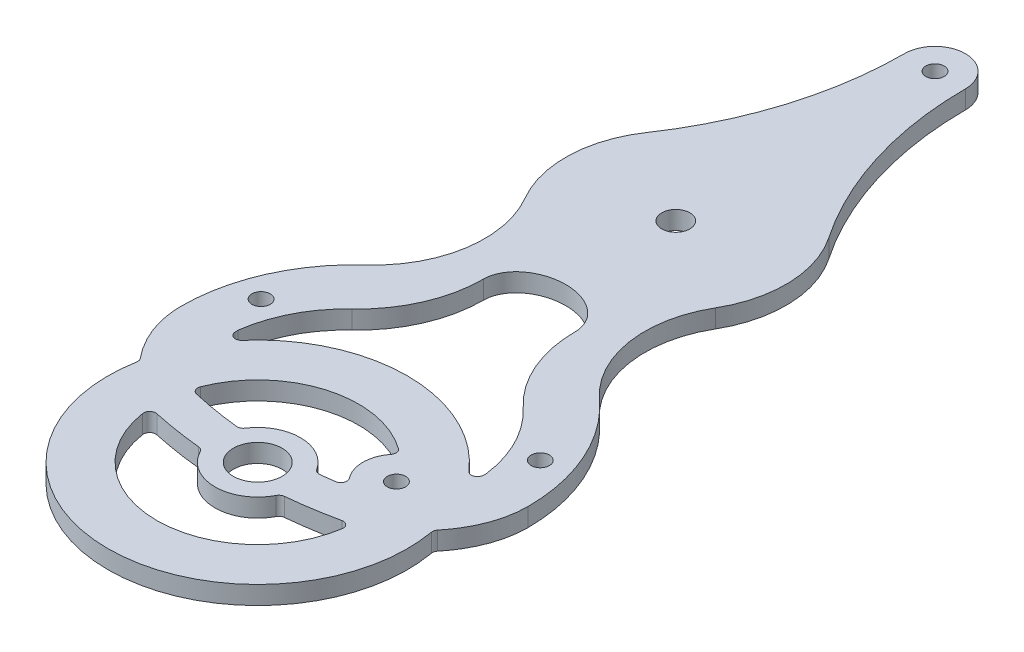
from build123d import *

# Parameters (mm, degrees)
SKETCH1_R           = 24.548545276
SKETCH1_R_2         = 16.548545276
BOSS_EXTRUDE1_DEPTH = 3
BOSS_EXTRUDE2_DEPTH = 3
SKETCH4_R           = 7
BOSS_EXTRUDE3_DEPTH = 3
FILLET1_R           = 1
SKETCH5_R           = 4
SKETCH5_R_2         = 1.5
CUT_EXTRUDE1_DEPTH  = 97.3335884
SKETCH6_R           = 1.5
SKETCH6_R_2         = 2.3
BOSS_EXTRUDE4_DEPTH = 3
FILLET2_R           = 1


with BuildPart() as part:
    # Sketch1 → Boss-Extrude1 (new body)
    with BuildSketch(Plane(origin=(0, 0, 0), x_dir=(1, 0, 0), z_dir=(0, 1, 0))):
        with Locations(Location((0, -68.556390977, 0), (0, 0, 270))):
            Circle(SKETCH1_R)
        with Locations(Location((0, -68.556390977, 0), (0, 0, 270))):
            Circle(SKETCH1_R_2, mode=Mode.SUBTRACT)
    extrude(amount=BOSS_EXTRUDE1_DEPTH)

    # Sketch2 → Boss-Extrude2 (add)
    with BuildSketch(Plane.XZ):
        with BuildLine():
            Line((-24.512516803, 67.2268816), (-23.428814897, 61.2268816))
            ThreePointArc((-23.428814897, 61.2268816), (0, 65.556390977), (23.428814897, 61.2268816))
            Line((23.428814897, 61.2268816), (24.512516803, 67.2268816))
            ThreePointArc((24.512516803, 67.2268816), (0, 71.556390977), (-24.512516803, 67.2268816))
        make_face()
    extrude(amount=-BOSS_EXTRUDE2_DEPTH)

    # Sketch4 → Boss-Extrude3 (add)
    with BuildSketch(Plane.XZ):
        with Locations((0, 68.556390977)):
            Circle(SKETCH4_R)
        with BuildLine():
            ThreePointArc((11.20668667, 64.591412524), (8.63715313, 60.358536924), (10.51197626, 55.775440079))
            ThreePointArc((10.51197626, 55.775440079), (13.727286847, 59.31431618), (15.796618214, 63.624737728))
            ThreePointArc((15.796618214, 63.624737728), (13.510301022, 64.149140012), (11.20668667, 64.591412524))
        make_face()
    extrude(amount=-BOSS_EXTRUDE3_DEPTH)

    # Fillet1
    fillet1_edges = [part.edges().sort_by_distance(p)[0] for p in [
        (-16.514023918, 1.5, 69.624737728),
        (16.514023918, 1.5, 69.624737728),
        (-15.796618214, 1.5, 63.624737728),
        (10.51197626, 1.5, 55.775440079),
        (11.20668667, 1.5, 64.591412524),
        (6.454864606, 1.5, 71.264660335),
        (-6.454864606, 1.5, 71.264660335),
        (-6.177743065, 1.5, 65.264660335),
        (6.177743065, 1.5, 65.264660335),
    ]]
    fillet(fillet1_edges, radius=FILLET1_R)

    # Sketch5 → Cut-Extrude1 (cut, through all)
    with BuildSketch(Plane(origin=(0, 3, 0), x_dir=(1, 0, 0), z_dir=(0, 1, 0))):
        with Locations(Location((0, -68.556390977, 0), (0, 0, 270))):
            Circle(SKETCH5_R)
        with Locations(Location((14.120155711, -59.926468993, 0), (0, 0, 270))):
            Circle(SKETCH5_R_2)
    extrude(amount=-CUT_EXTRUDE1_DEPTH, mode=Mode.SUBTRACT)

    # Sketch6 → Boss-Extrude4 (add)
    with BuildSketch(Plane.XZ):
        with BuildLine():
            ThreePointArc((-28.443609023, 52.689830928), (-25.998546823, 41.152307046), (-19.083723838, 31.598354482))
            ThreePointArc((-19.083723838, 31.598354482), (-13.352587893, 20.968024673), (-15.601179111, 9.102373886))
            ThreePointArc((-15.601179111, 9.102373886), (-18.051873862, -0.616319792), (-14.944034973, -10.145236258))
            ThreePointArc((-14.944034973, -10.145236258), (-7.542106487, -25.574270902), (-5, -42.497076519))
            ThreePointArc((-5, -42.497076519), (0, -47.497076519), (5, -42.497076519))
            ThreePointArc((5, -42.497076519), (7.542106487, -25.574270902), (14.944034973, -10.145236258))
            ThreePointArc((14.944034973, -10.145236258), (18.051873862, -0.616319792), (15.601179111, 9.102373886))
            ThreePointArc((15.601179111, 9.102373886), (13.352587893, 20.968024673), (19.083723838, 31.598354482))
            ThreePointArc((19.083723838, 31.598354482), (25.998546823, 41.152307046), (28.443609023, 52.689830928))
            add(Edge.make_bspline(
                [(28.443609023, 52.689830928), (28.443609023, 58.702729125), (24.082089511, 63.793614479)],
                knots=[3.141592654, 3.141592654, 3.141592654, 3.702710446, 3.702710446, 3.702710446], degree=2, weights=[1, 0.960900834, 1]))
            ThreePointArc((24.082089511, 63.793614479), (22.506139956, 58.753088501), (19.888578123, 54.16627161))
            add(Edge.make_bspline(
                [(20.362751378, 51.417293233), (20.362751378, 52.807974334), (19.888578123, 54.16627161)],
                knots=[3.141592654, 3.141592654, 3.141592654, 3.357820527, 3.357820527, 3.357820527], degree=2, weights=[1, 0.994161379, 1]))
            ThreePointArc((20.362751378, 51.417293233), (18.267033213, 44.675293544), (14.017032804, 39.037555438))
            ThreePointArc((14.017032804, 39.037555438), (9.199384108, 32.198414932), (7.5, 24.007219936))
            add(Edge.make_bspline(
                [(-7.5, 24.007219936), (-7.5, 18.062391868), (0, 18.062391868), (7.5, 18.062391868), (7.5, 24.007219936)],
                knots=[0, 0, 0, 1.570796327, 1.570796327, 3.141592654, 3.141592654, 3.141592654], degree=2, weights=[1, 0.707106781, 1, 0.707106781, 1]))
            ThreePointArc((-7.5, 24.007219936), (-9.199384108, 32.198414932), (-14.017032804, 39.037555438))
            ThreePointArc((-14.017032804, 39.037555438), (-18.267033213, 44.675293544), (-20.362751378, 51.417293233))
            add(Edge.make_bspline(
                [(-19.888578123, 54.16627161), (-20.362751378, 52.807974334), (-20.362751378, 51.417293233)],
                knots=[2.92536478, 2.92536478, 2.92536478, 3.141592654, 3.141592654, 3.141592654], degree=2, weights=[1, 0.994161379, 1]))
            ThreePointArc((-19.888578123, 54.16627161), (-22.506139956, 58.753088501), (-24.082089511, 63.793614479))
            add(Edge.make_bspline(
                [(-24.082089511, 63.793614479), (-28.443609023, 58.702729125), (-28.443609023, 52.689830928)],
                knots=[2.580474861, 2.580474861, 2.580474861, 3.141592654, 3.141592654, 3.141592654], degree=2, weights=[1, 0.960900834, 1]))
        make_face()
        with Locations(Location((-22.896149501, 45.11234526, 0), (0, 0, 270))):
            Circle(SKETCH6_R, mode=Mode.SUBTRACT)
        with Locations(Location((0, -42.497076519, 0), (0, 0, 270))):
            Circle(SKETCH6_R, mode=Mode.SUBTRACT)
        with Locations(Location((0, 0, 0), (0, 0, 270))):
            Circle(SKETCH6_R_2, mode=Mode.SUBTRACT)
        with Locations(Location((22.896149501, 45.11234526, 0), (0, 0, 90))):
            Circle(SKETCH6_R, mode=Mode.SUBTRACT)
    extrude(amount=-BOSS_EXTRUDE4_DEPTH)

    # Fillet2
    fillet2_edges = [part.edges().sort_by_distance(p)[0] for p in [
        (19.888578123, 1.5, 54.16627161),
        (-19.888578123, 1.5, 54.16627161),
        (24.082089511, 1.5, 63.793614479),
        (-24.082089511, 1.5, 63.793614479),
    ]]
    fillet(fillet2_edges, radius=FILLET2_R)


solid = part.part
